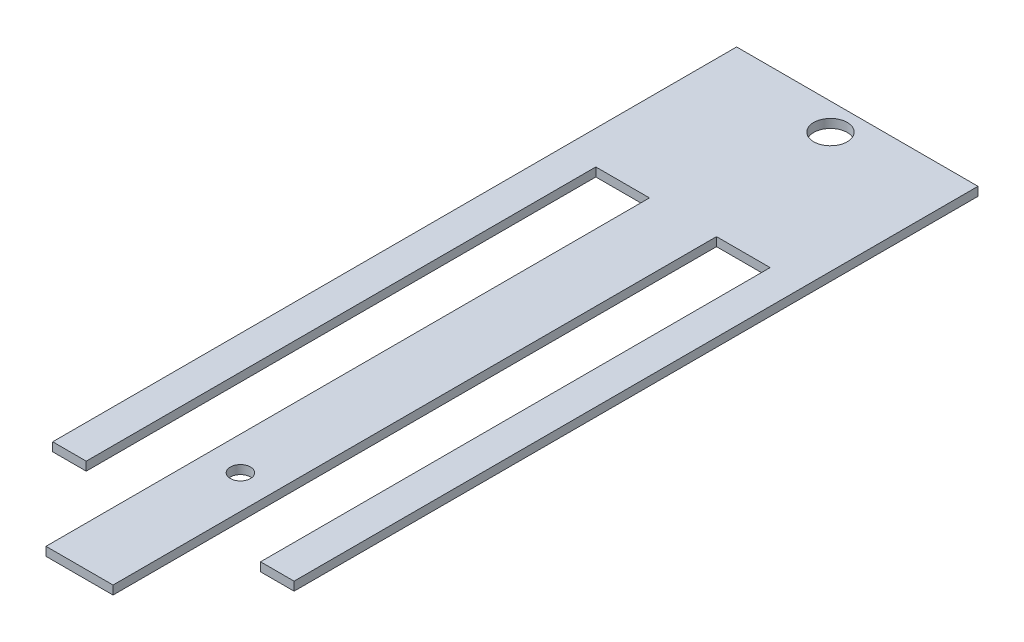
from build123d import *

# Parameters (mm, degrees)
SKETCH_1_W          = 5
SKETCH_1_H          = 58
EXTRUDE_1_DEPTH     = 0.65
SKETCH_2_R          = 1.25
CUT_EXTRUDE_1_DEPTH = 10
SKETCH_3_R          = 0.75
CUT_EXTRUDE_2_DEPTH = 10


with BuildPart() as part:
    # 草图1 → 凸台-拉伸1 (new body)
    with BuildSketch(Plane(origin=(0, 0, 0), x_dir=(1, 0, 0), z_dir=(0, 1, 0))):
        Polygon((-2.5, 16), (-2.5, 29), (-9, 29), (-9, -22), (-6.5, -22), (-6.5, 16), align=None)
        Rectangle(SKETCH_1_W, SKETCH_1_H)
        Polygon((9, 29), (2.5, 29), (2.5, 16), (6.5, 16), (6.5, -22), (9, -22), align=None)
    extrude(amount=EXTRUDE_1_DEPTH)

    # 草图2 → 切除-拉伸1 (cut)
    with BuildSketch(Plane(origin=(0, 0.65, 0), x_dir=(1, 0, 0), z_dir=(0, 1, 0))):
        with Locations(Location((0, 27, 0), (0, 0, 270))):
            Circle(SKETCH_2_R)
    extrude(amount=-CUT_EXTRUDE_1_DEPTH, mode=Mode.SUBTRACT)

    # 草图3 → 切除-拉伸2 (cut)
    with BuildSketch(Plane.XZ):
        with Locations(Location((0, 17, 0), (0, 0, 270))):
            Circle(SKETCH_3_R)
    extrude(amount=-CUT_EXTRUDE_2_DEPTH, mode=Mode.SUBTRACT)


solid = part.part
